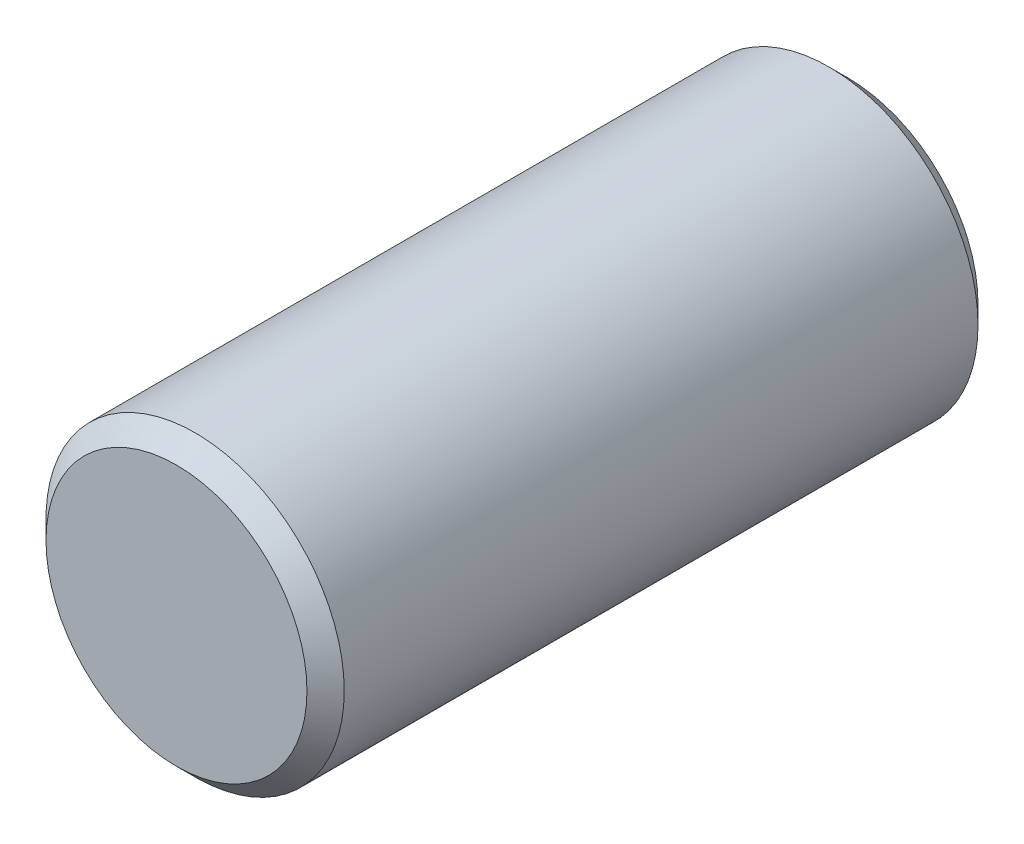
from build123d import *

# Parameters (mm, degrees)
SCHIZZO1_R                   = 4
ESTRUSIONE_ESTRUSIONE1_DEPTH = 18
SMUSSO1_SIZE                 = 0.5


with BuildPart() as part:
    # Schizzo1 → Estrusione-Estrusione1 (new body)
    with BuildSketch(Plane.XY):
        Circle(SCHIZZO1_R)
    extrude(amount=ESTRUSIONE_ESTRUSIONE1_DEPTH)

    # Smusso1
    smusso1_edges = [part.edges().sort_by_distance(p)[0] for p in [
        (-4, 0, 0),
        (-4, 0, 18),
    ]]
    chamfer(smusso1_edges, length=SMUSSO1_SIZE)


solid = part.part
